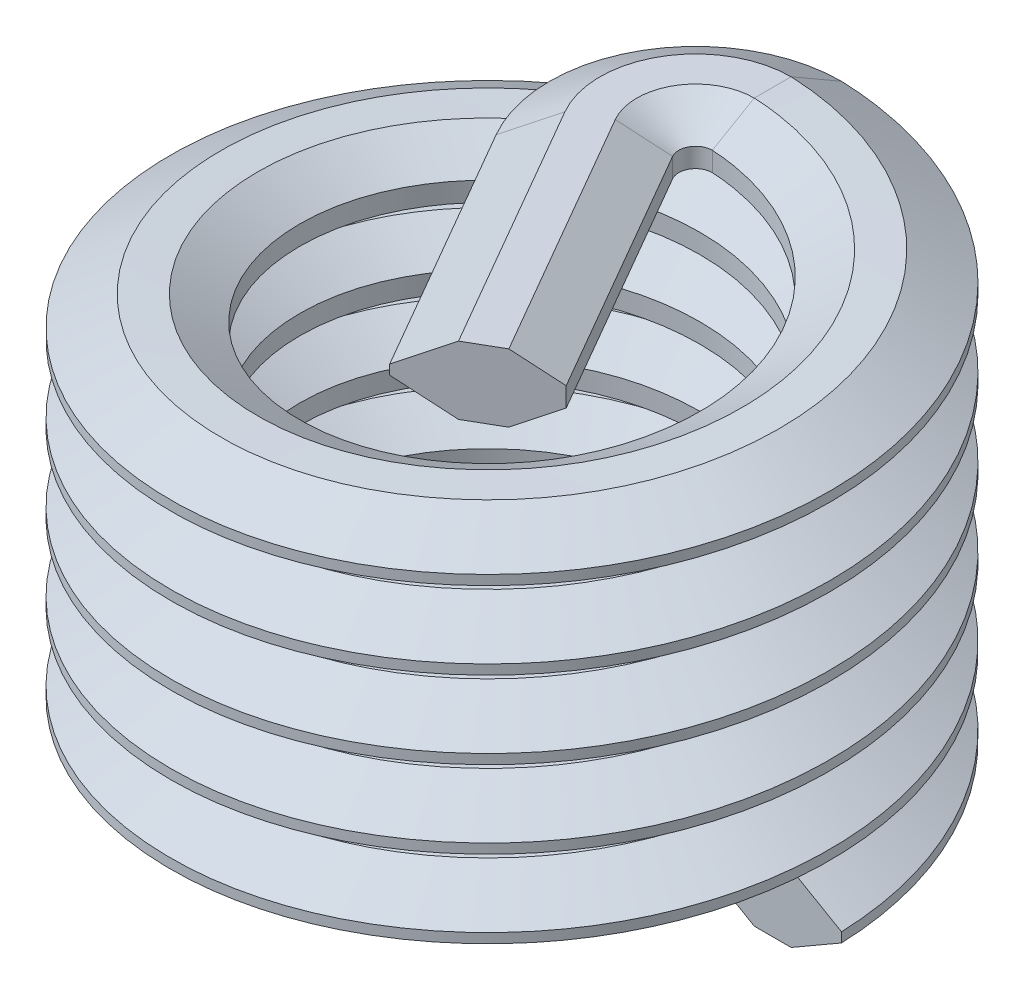
from build123d import *

# Parameters (mm, degrees)
SWEEP1_PITCH       = 0.8
SWEEP1_HEIGHT      = 4.2
SWEEP1_RADIUS      = 2.5
SWEEP1_START_ANGLE = 90
REVOLVE1_ANGLE     = 120
EXTRUDE1_DEPTH     = 3


with BuildPart() as part:
    # Sweep1: sweep along a helix
    with BuildLine() as sweep1_path:
        add(Helix(SWEEP1_PITCH, SWEEP1_HEIGHT, SWEEP1_RADIUS, center=(0, 0, 0), direction=(0, 1, 0), mode=Mode.PRIVATE).rotate(Axis((0, 0, 0), (0, 1, 0)), SWEEP1_START_ANGLE))
    # Sketch1 → Sweep1 (sweep)
    with BuildSketch(Plane(origin=(0, 0, 0), x_dir=(-1, 0, 0), z_dir=(0, 0, 1))):
        Polygon((-3.4, -0.05), (-2.880384758, -0.35), (-2.5, -0.35), (-2.066987298, -0.1), (-2.066987298, 0.1), (-2.5, 0.35), (-2.880384758, 0.35), (-3.4, 0.05), align=None)
    sweep(path=sweep1_path.line, is_frenet=True)


with BuildPart() as body_2:
    # Sketch3 → Revolve1 (revolve)
    with BuildSketch(Plane.ZY):
        Polygon((-2.5, 3.85), (-2.066987298, 4.1), (-2.066987298, 4.3), (-2.5, 4.55), (-2.880384758, 4.55), (-3.4, 4.25), (-3.4, 4.15), (-2.880384758, 3.85), align=None)
    revolve(axis=Axis((0, 4.2, -1.893782217), (0, 1, 0)), revolution_arc=REVOLVE1_ANGLE)

    # Sketch4 → Extrude1 (add)
    with BuildSketch(Plane(origin=(-0.820031755, 0, -1.420336663), x_dir=(0.8660254037844364, -1.3357377991210578e-09, -0.5000000000000041), z_dir=(0.5000000000000041, 0, 0.8660254037844364))):
        Polygon((-0.039711437, 3.85), (0.340673321, 3.85), (0.773686022, 4.100000001), (0.773686022, 4.300000001), (0.34067332, 4.55), (-0.039711438, 4.55), (-0.55932668, 4.249999999), (-0.55932668, 4.149999999), align=None)
    extrude(amount=EXTRUDE1_DEPTH)


solid = Compound([part.part, body_2.part])
